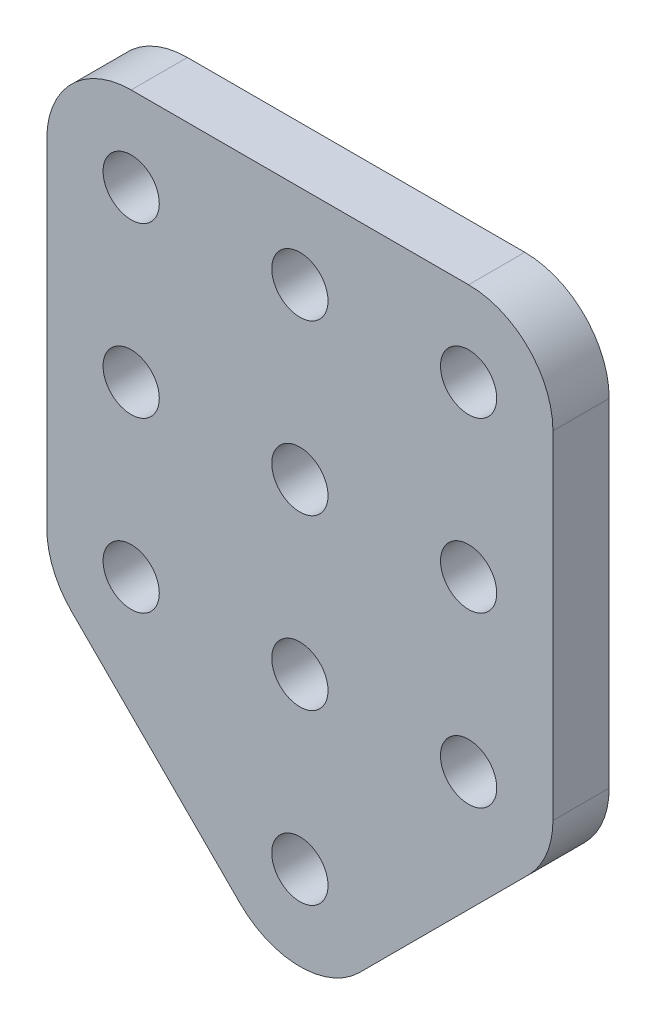
from build123d import *

# Parameters (mm, degrees)
MODEL_R                 = 1.5
SALIENTE_EXTRUIR1_DEPTH = 3


with BuildPart() as part:
    # Model → Saliente-Extruir1 (new body)
    with BuildSketch(Plane.XY):
        with BuildLine():
            Line((174.227054575, 213.178720063), (174.227054575, 204.178720063))
            ThreePointArc((174.227054575, 204.178720063), (174.569596678, 202.456644617), (175.545074059, 200.996739548))
            Line((175.545074059, 200.996739548), (184.545074059, 191.996739548))
            ThreePointArc((184.545074059, 191.996739548), (187.727054575, 190.678720063), (190.90903509, 191.996739548))
            Line((190.90903509, 191.996739548), (199.90903509, 200.996739548))
            ThreePointArc((199.90903509, 200.996739548), (200.884512471, 202.456644617), (201.227054575, 204.178720063))
            Line((201.227054575, 204.178720063), (201.227054575, 222.178720063))
            ThreePointArc((201.227054575, 222.178720063), (199.90903509, 225.360700578), (196.727054575, 226.678720063))
            Line((196.727054575, 226.678720063), (178.727054575, 226.678720063))
            ThreePointArc((178.727054575, 226.678720063), (175.545074059, 225.360700578), (174.227054575, 222.178720063))
            Line((174.227054575, 222.178720063), (174.227054575, 213.178720063))
        make_face()
        with Locations((187.727054575, 204.178720063)):
            Circle(MODEL_R, mode=Mode.SUBTRACT)
        with Locations((178.727054575, 204.178720063)):
            Circle(MODEL_R, mode=Mode.SUBTRACT)
        with Locations((187.727054575, 213.178720063)):
            Circle(MODEL_R, mode=Mode.SUBTRACT)
        with Locations((178.727054575, 213.178720063)):
            Circle(MODEL_R, mode=Mode.SUBTRACT)
        with Locations((196.727054575, 213.178720063)):
            Circle(MODEL_R, mode=Mode.SUBTRACT)
        with Locations((187.727054575, 195.178720063)):
            Circle(MODEL_R, mode=Mode.SUBTRACT)
        with Locations((196.727054575, 204.178720063)):
            Circle(MODEL_R, mode=Mode.SUBTRACT)
        with Locations((187.727054575, 222.178720063)):
            Circle(MODEL_R, mode=Mode.SUBTRACT)
        with Locations((178.727054575, 222.178720063)):
            Circle(MODEL_R, mode=Mode.SUBTRACT)
        with Locations((196.727054575, 222.178720063)):
            Circle(MODEL_R, mode=Mode.SUBTRACT)
    extrude(amount=SALIENTE_EXTRUIR1_DEPTH)


solid = part.part
